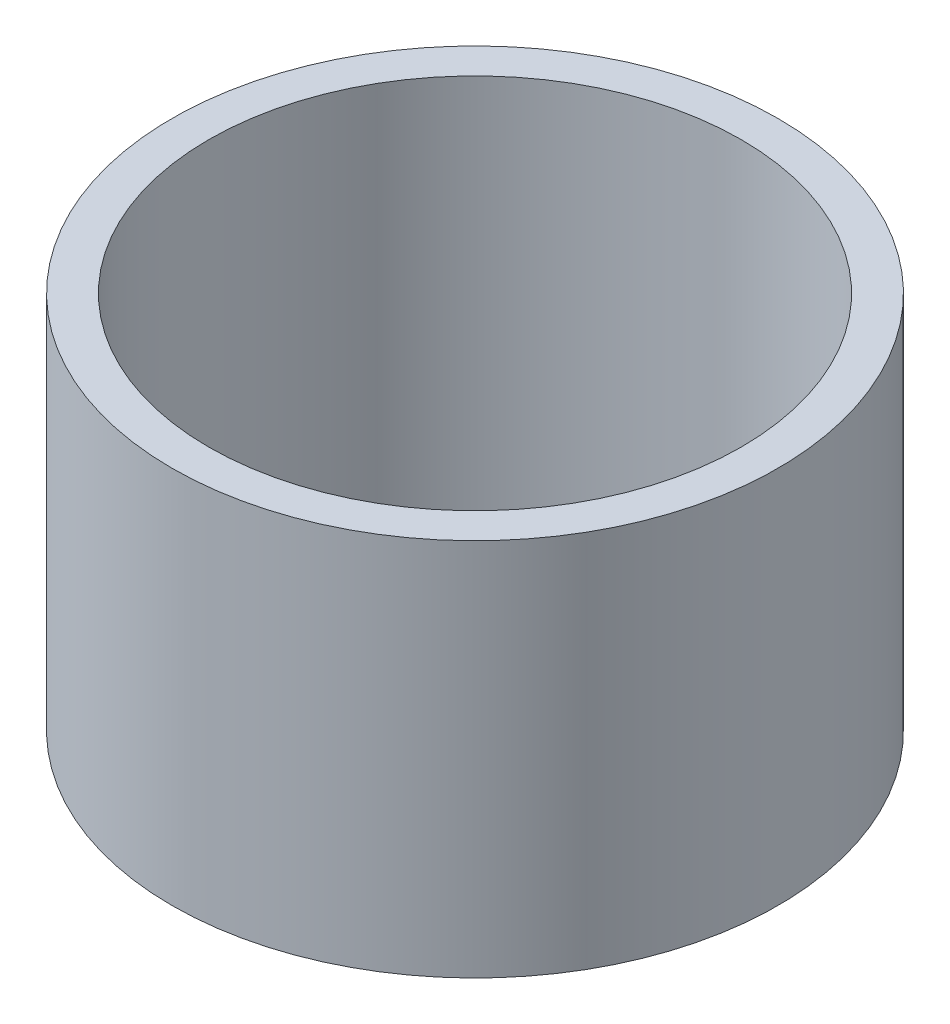
from build123d import *

# Parameters (mm, degrees)
SKETCH1_R           = 12.8
BOSS_EXTRUDE1_DEPTH = 16
SKETCH3_R           = 11.25
CUT_EXTRUDE2_DEPTH  = 25.159470193


with BuildPart() as part:
    # Sketch1 → Boss-Extrude1 (new body)
    with BuildSketch(Plane(origin=(0, 0, 0), x_dir=(1, 0, 0), z_dir=(0, 1, 0))):
        with Locations(Location((0, 0, 0), (0, 0, 270))):
            Circle(SKETCH1_R)
    extrude(amount=BOSS_EXTRUDE1_DEPTH)

    # Sketch3 → Cut-Extrude2 (cut, through all)
    with BuildSketch(Plane(origin=(0, 16, 0), x_dir=(1, 0, 0), z_dir=(0, 1, 0))):
        with Locations(Location((0, 0, 0), (0, 0, 270))):
            Circle(SKETCH3_R)
    extrude(amount=-CUT_EXTRUDE2_DEPTH, mode=Mode.SUBTRACT)


solid = part.part
